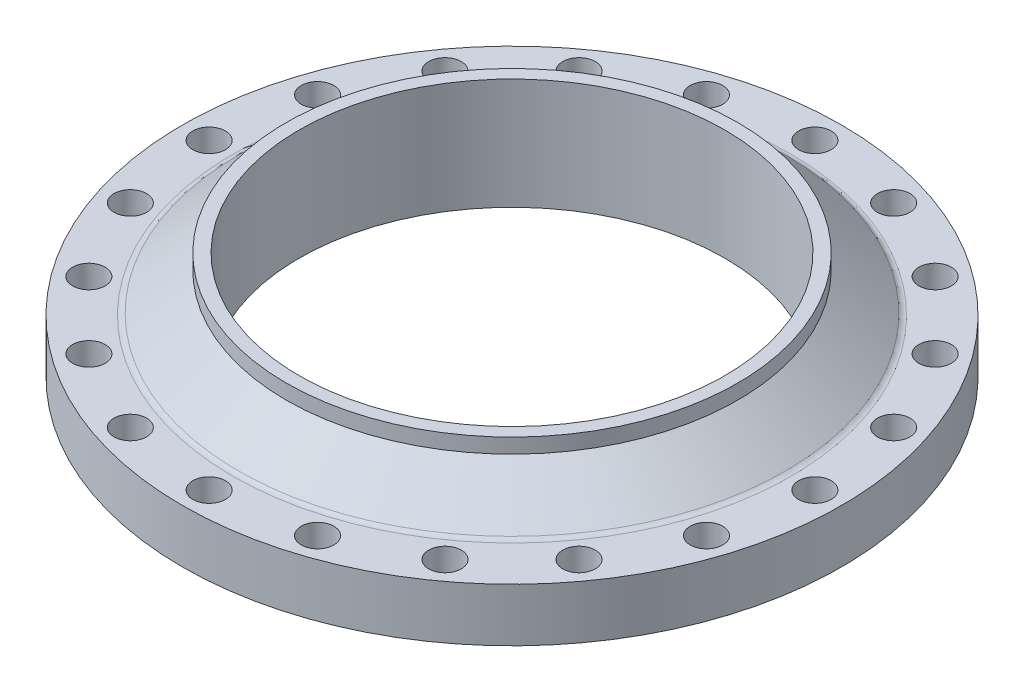
from build123d import *

# Parameters (mm, degrees)
CUT_EXTRUDE1_REACH = 647.813
SKETCH2_R          = 22


with BuildPart() as part:
    # Sketch1 → Revolve1 (revolve)
    with BuildSketch(Plane.XY, mode=Mode.PRIVATE) as revolve1_sk:
        with BuildLine():
            Line((287.4, 50.811932791), (287.4, 200.811932791))
            Line((287.4, 200.811932791), (304.8, 200.811932791))
            Line((304.8, 200.811932791), (304.8, 180.811932791))
            Line((304.8, 180.811932791), (369.380900162, 130.355803748))
            ThreePointArc((369.380900162, 130.355803748), (372.862020012, 128.465709884), (376.768837866, 127.811932791))
            Line((376.768837866, 127.811932791), (445, 127.811932791))
            Line((445, 127.811932791), (445, 55.811932791))
            Line((445, 55.811932791), (375, 55.811932791))
            Line((375, 55.811932791), (370, 50.811932791))
            Line((370, 50.811932791), (287.4, 50.811932791))
        make_face()
    revolve(revolve1_sk.sketch.rotate(Axis((0, 0, 0), (0, 1, 0)), 90), axis=Axis((0, 0, 0), (0, 1, 0)))

    # Sketch2 → Cut-Extrude1 (cut, up to next)
    with BuildSketch(Plane.XZ.offset(-55.811932791), mode=Mode.PRIVATE) as cut_extrude1_sk1:
        with Locations(Location((0, 409, 0), (0, 0, 270))):
            Circle(SKETCH2_R)
    cut_extrude1_tool1 = extrude(cut_extrude1_sk1.sketch, amount=-CUT_EXTRUDE1_REACH, mode=Mode.PRIVATE) & part.part
    # Sketch2 → Cut-Extrude1 (cut, up to next)
    with BuildSketch(Plane.XZ.offset(-55.811932791), mode=Mode.PRIVATE) as cut_extrude1_sk2:
        with Locations(Location((126.387950699, 388.982115165, 0), (0, 0, 270))):
            Circle(SKETCH2_R)
    cut_extrude1_tool2 = extrude(cut_extrude1_sk2.sketch, amount=-CUT_EXTRUDE1_REACH, mode=Mode.PRIVATE) & part.part
    # Sketch2 → Cut-Extrude1 (cut, up to next)
    with BuildSketch(Plane.XZ.offset(-55.811932791), mode=Mode.PRIVATE) as cut_extrude1_sk3:
        with Locations(Location((240.404168188, 330.887950699, 0), (0, 0, 270))):
            Circle(SKETCH2_R)
    cut_extrude1_tool3 = extrude(cut_extrude1_sk3.sketch, amount=-CUT_EXTRUDE1_REACH, mode=Mode.PRIVATE) & part.part
    # Sketch2 → Cut-Extrude1 (cut, up to next)
    with BuildSketch(Plane.XZ.offset(-55.811932791), mode=Mode.PRIVATE) as cut_extrude1_sk4:
        with Locations(Location((330.887950699, 240.404168188, 0), (0, 0, 270))):
            Circle(SKETCH2_R)
    cut_extrude1_tool4 = extrude(cut_extrude1_sk4.sketch, amount=-CUT_EXTRUDE1_REACH, mode=Mode.PRIVATE) & part.part
    # Sketch2 → Cut-Extrude1 (cut, up to next)
    with BuildSketch(Plane.XZ.offset(-55.811932791), mode=Mode.PRIVATE) as cut_extrude1_sk5:
        with Locations(Location((388.982115165, 126.387950699, 0), (0, 0, 270))):
            Circle(SKETCH2_R)
    cut_extrude1_tool5 = extrude(cut_extrude1_sk5.sketch, amount=-CUT_EXTRUDE1_REACH, mode=Mode.PRIVATE) & part.part
    # Sketch2 → Cut-Extrude1 (cut, up to next)
    with BuildSketch(Plane.XZ.offset(-55.811932791), mode=Mode.PRIVATE) as cut_extrude1_sk6:
        with Locations(Location((409, 0, 0), (0, 0, 270))):
            Circle(SKETCH2_R)
    cut_extrude1_tool6 = extrude(cut_extrude1_sk6.sketch, amount=-CUT_EXTRUDE1_REACH, mode=Mode.PRIVATE) & part.part
    # Sketch2 → Cut-Extrude1 (cut, up to next)
    with BuildSketch(Plane.XZ.offset(-55.811932791), mode=Mode.PRIVATE) as cut_extrude1_sk7:
        with Locations(Location((388.982115165, -126.387950699, 0), (0, 0, 270))):
            Circle(SKETCH2_R)
    cut_extrude1_tool7 = extrude(cut_extrude1_sk7.sketch, amount=-CUT_EXTRUDE1_REACH, mode=Mode.PRIVATE) & part.part
    # Sketch2 → Cut-Extrude1 (cut, up to next)
    with BuildSketch(Plane.XZ.offset(-55.811932791), mode=Mode.PRIVATE) as cut_extrude1_sk8:
        with Locations(Location((330.887950699, -240.404168188, 0), (0, 0, 270))):
            Circle(SKETCH2_R)
    cut_extrude1_tool8 = extrude(cut_extrude1_sk8.sketch, amount=-CUT_EXTRUDE1_REACH, mode=Mode.PRIVATE) & part.part
    # Sketch2 → Cut-Extrude1 (cut, up to next)
    with BuildSketch(Plane.XZ.offset(-55.811932791), mode=Mode.PRIVATE) as cut_extrude1_sk9:
        with Locations(Location((240.404168188, -330.887950699, 0), (0, 0, 270))):
            Circle(SKETCH2_R)
    cut_extrude1_tool9 = extrude(cut_extrude1_sk9.sketch, amount=-CUT_EXTRUDE1_REACH, mode=Mode.PRIVATE) & part.part
    # Sketch2 → Cut-Extrude1 (cut, up to next)
    with BuildSketch(Plane.XZ.offset(-55.811932791), mode=Mode.PRIVATE) as cut_extrude1_sk10:
        with Locations(Location((126.387950699, -388.982115165, 0), (0, 0, 270))):
            Circle(SKETCH2_R)
    cut_extrude1_tool10 = extrude(cut_extrude1_sk10.sketch, amount=-CUT_EXTRUDE1_REACH, mode=Mode.PRIVATE) & part.part
    # Sketch2 → Cut-Extrude1 (cut, up to next)
    with BuildSketch(Plane.XZ.offset(-55.811932791), mode=Mode.PRIVATE) as cut_extrude1_sk11:
        with Locations(Location((0, -409, 0), (0, 0, 270))):
            Circle(SKETCH2_R)
    cut_extrude1_tool11 = extrude(cut_extrude1_sk11.sketch, amount=-CUT_EXTRUDE1_REACH, mode=Mode.PRIVATE) & part.part
    # Sketch2 → Cut-Extrude1 (cut, up to next)
    with BuildSketch(Plane.XZ.offset(-55.811932791), mode=Mode.PRIVATE) as cut_extrude1_sk12:
        with Locations(Location((-126.387950699, -388.982115165, 0), (0, 0, 270))):
            Circle(SKETCH2_R)
    cut_extrude1_tool12 = extrude(cut_extrude1_sk12.sketch, amount=-CUT_EXTRUDE1_REACH, mode=Mode.PRIVATE) & part.part
    # Sketch2 → Cut-Extrude1 (cut, up to next)
    with BuildSketch(Plane.XZ.offset(-55.811932791), mode=Mode.PRIVATE) as cut_extrude1_sk13:
        with Locations(Location((-240.404168188, -330.887950699, 0), (0, 0, 270))):
            Circle(SKETCH2_R)
    cut_extrude1_tool13 = extrude(cut_extrude1_sk13.sketch, amount=-CUT_EXTRUDE1_REACH, mode=Mode.PRIVATE) & part.part
    # Sketch2 → Cut-Extrude1 (cut, up to next)
    with BuildSketch(Plane.XZ.offset(-55.811932791), mode=Mode.PRIVATE) as cut_extrude1_sk14:
        with Locations(Location((-330.887950699, -240.404168188, 0), (0, 0, 270))):
            Circle(SKETCH2_R)
    cut_extrude1_tool14 = extrude(cut_extrude1_sk14.sketch, amount=-CUT_EXTRUDE1_REACH, mode=Mode.PRIVATE) & part.part
    # Sketch2 → Cut-Extrude1 (cut, up to next)
    with BuildSketch(Plane.XZ.offset(-55.811932791), mode=Mode.PRIVATE) as cut_extrude1_sk15:
        with Locations(Location((-388.982115165, -126.387950699, 0), (0, 0, 270))):
            Circle(SKETCH2_R)
    cut_extrude1_tool15 = extrude(cut_extrude1_sk15.sketch, amount=-CUT_EXTRUDE1_REACH, mode=Mode.PRIVATE) & part.part
    # Sketch2 → Cut-Extrude1 (cut, up to next)
    with BuildSketch(Plane.XZ.offset(-55.811932791), mode=Mode.PRIVATE) as cut_extrude1_sk16:
        with Locations(Location((-409, 0, 0), (0, 0, 270))):
            Circle(SKETCH2_R)
    cut_extrude1_tool16 = extrude(cut_extrude1_sk16.sketch, amount=-CUT_EXTRUDE1_REACH, mode=Mode.PRIVATE) & part.part
    # Sketch2 → Cut-Extrude1 (cut, up to next)
    with BuildSketch(Plane.XZ.offset(-55.811932791), mode=Mode.PRIVATE) as cut_extrude1_sk17:
        with Locations(Location((-388.982115165, 126.387950699, 0), (0, 0, 270))):
            Circle(SKETCH2_R)
    cut_extrude1_tool17 = extrude(cut_extrude1_sk17.sketch, amount=-CUT_EXTRUDE1_REACH, mode=Mode.PRIVATE) & part.part
    # Sketch2 → Cut-Extrude1 (cut, up to next)
    with BuildSketch(Plane.XZ.offset(-55.811932791), mode=Mode.PRIVATE) as cut_extrude1_sk18:
        with Locations(Location((-330.887950699, 240.404168188, 0), (0, 0, 270))):
            Circle(SKETCH2_R)
    cut_extrude1_tool18 = extrude(cut_extrude1_sk18.sketch, amount=-CUT_EXTRUDE1_REACH, mode=Mode.PRIVATE) & part.part
    # Sketch2 → Cut-Extrude1 (cut, up to next)
    with BuildSketch(Plane.XZ.offset(-55.811932791), mode=Mode.PRIVATE) as cut_extrude1_sk19:
        with Locations(Location((-240.404168188, 330.887950699, 0), (0, 0, 270))):
            Circle(SKETCH2_R)
    cut_extrude1_tool19 = extrude(cut_extrude1_sk19.sketch, amount=-CUT_EXTRUDE1_REACH, mode=Mode.PRIVATE) & part.part
    # Sketch2 → Cut-Extrude1 (cut, up to next)
    with BuildSketch(Plane.XZ.offset(-55.811932791), mode=Mode.PRIVATE) as cut_extrude1_sk20:
        with Locations(Location((-126.387950699, 388.982115165, 0), (0, 0, 270))):
            Circle(SKETCH2_R)
    cut_extrude1_tool20 = extrude(cut_extrude1_sk20.sketch, amount=-CUT_EXTRUDE1_REACH, mode=Mode.PRIVATE) & part.part
    add(cut_extrude1_tool1.solids().sort_by_distance((0, 55.811933, 409))[0], mode=Mode.SUBTRACT)
    add(cut_extrude1_tool2.solids().sort_by_distance((126.387951, 55.811933, 388.982115))[0], mode=Mode.SUBTRACT)
    add(cut_extrude1_tool3.solids().sort_by_distance((240.404168, 55.811933, 330.887951))[0], mode=Mode.SUBTRACT)
    add(cut_extrude1_tool4.solids().sort_by_distance((330.887951, 55.811933, 240.404168))[0], mode=Mode.SUBTRACT)
    add(cut_extrude1_tool5.solids().sort_by_distance((388.982115, 55.811933, 126.387951))[0], mode=Mode.SUBTRACT)
    add(cut_extrude1_tool6.solids().sort_by_distance((409, 55.811933, 0))[0], mode=Mode.SUBTRACT)
    add(cut_extrude1_tool7.solids().sort_by_distance((388.982115, 55.811933, -126.387951))[0], mode=Mode.SUBTRACT)
    add(cut_extrude1_tool8.solids().sort_by_distance((330.887951, 55.811933, -240.404168))[0], mode=Mode.SUBTRACT)
    add(cut_extrude1_tool9.solids().sort_by_distance((240.404168, 55.811933, -330.887951))[0], mode=Mode.SUBTRACT)
    add(cut_extrude1_tool10.solids().sort_by_distance((126.387951, 55.811933, -388.982115))[0], mode=Mode.SUBTRACT)
    add(cut_extrude1_tool11.solids().sort_by_distance((0, 55.811933, -409))[0], mode=Mode.SUBTRACT)
    add(cut_extrude1_tool12.solids().sort_by_distance((-126.387951, 55.811933, -388.982115))[0], mode=Mode.SUBTRACT)
    add(cut_extrude1_tool13.solids().sort_by_distance((-240.404168, 55.811933, -330.887951))[0], mode=Mode.SUBTRACT)
    add(cut_extrude1_tool14.solids().sort_by_distance((-330.887951, 55.811933, -240.404168))[0], mode=Mode.SUBTRACT)
    add(cut_extrude1_tool15.solids().sort_by_distance((-388.982115, 55.811933, -126.387951))[0], mode=Mode.SUBTRACT)
    add(cut_extrude1_tool16.solids().sort_by_distance((-409, 55.811933, 0))[0], mode=Mode.SUBTRACT)
    add(cut_extrude1_tool17.solids().sort_by_distance((-388.982115, 55.811933, 126.387951))[0], mode=Mode.SUBTRACT)
    add(cut_extrude1_tool18.solids().sort_by_distance((-330.887951, 55.811933, 240.404168))[0], mode=Mode.SUBTRACT)
    add(cut_extrude1_tool19.solids().sort_by_distance((-240.404168, 55.811933, 330.887951))[0], mode=Mode.SUBTRACT)
    add(cut_extrude1_tool20.solids().sort_by_distance((-126.387951, 55.811933, 388.982115))[0], mode=Mode.SUBTRACT)


solid = part.part
